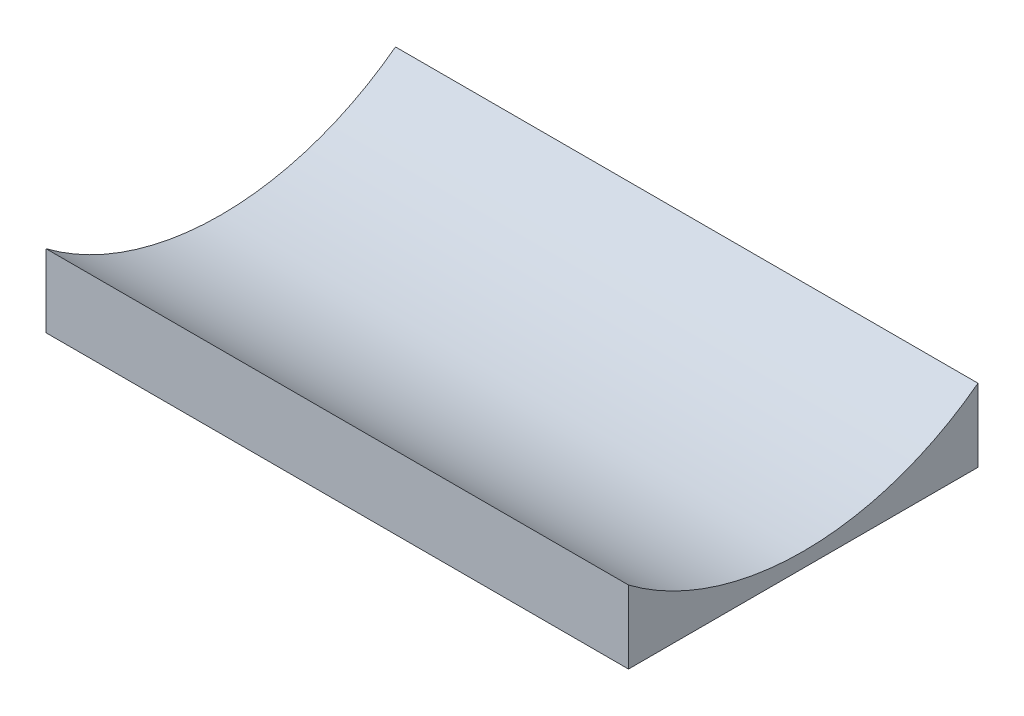
from build123d import *

# Parameters (mm, degrees)
SKETCH1_W               = 100
SKETCH1_H               = 60
BOSS_EXTRUDE4_DEPTH     = 10
CUT_EXTRUDE1_DEPTH      = 105.880884817
CUT_EXTRUDE1_DEPTH_BACK = 100
SKETCH3_W               = 59.99788365
SKETCH3_H               = 10
BOSS_EXTRUDE5_DEPTH     = 100
SKETCH4_W               = 100
SKETCH4_H               = 5
CUT_EXTRUDE2_DEPTH      = 60
SKETCH5_W               = 100
SKETCH5_H               = 2.5
CUT_EXTRUDE3_DEPTH      = 60


with BuildPart() as part:
    # Sketch1 → Boss-Extrude4 (new body)
    with BuildSketch(Plane(origin=(0, 0, 0), x_dir=(1, 0, 0), z_dir=(0, 1, 0))):
        Rectangle(SKETCH1_W, SKETCH1_H)
    extrude(amount=BOSS_EXTRUDE4_DEPTH)

    # Sketch2 → Cut-Extrude1 (cut, two sides: drawn at the far end of the back side and taken through both)
    with BuildSketch(Plane(origin=(50, 0, 0), x_dir=(0, 0, -1), z_dir=(1, 0, 0)).offset(-CUT_EXTRUDE1_DEPTH_BACK)):
        with BuildLine():
            Line((-135.324200485, 88.993150364), (-30, 10))
            ThreePointArc((-30, 10), (0, 0), (30, 10))
            Line((30, 10), (135.324200485, 88.993150364))
            Line((135.324200485, 88.993150364), (135.324200485, 352.303651576))
            Line((135.324200485, 352.303651576), (-135.324200485, 352.303651576))
            Line((-135.324200485, 352.303651576), (-135.324200485, 88.993150364))
        make_face()
    extrude(amount=CUT_EXTRUDE1_DEPTH + CUT_EXTRUDE1_DEPTH_BACK, mode=Mode.SUBTRACT)


with BuildPart() as cut_extrude1_piece_1:
    # of the separate pieces the step leaves, piece 1, a body of its own (cut_extrude1_pieces)
    add(part.part.solids().sort_by_distance((50, 0, 30))[0])



with BuildPart() as cut_extrude1_piece_2:
    # of the separate pieces the step leaves, piece 2, a body of its own (cut_extrude1_pieces)
    add(part.part.solids().sort_by_distance((50, 0, -30))[0])


with BuildPart() as cut_extrude1_piece_1_1:
    add(cut_extrude1_piece_1.part)

    add(cut_extrude1_piece_2.part)  # Boss-Extrude5 merges Cut-Extrude1 piece 2
    # Sketch3 → Boss-Extrude5 (add)
    with BuildSketch(Plane(origin=(50, 0, 0), x_dir=(0, 0, -1), z_dir=(1, 0, 0))):
        with Locations((-0.001058175, -5)):
            Rectangle(SKETCH3_W, SKETCH3_H)
    extrude(amount=-BOSS_EXTRUDE5_DEPTH)

    # Sketch4 → Cut-Extrude2 (cut)
    with BuildSketch(Plane(origin=(0, 0, -29.99788365), x_dir=(-1, 0, 0), z_dir=(0, 0, -1))):
        with Locations((0, -7.5)):
            Rectangle(SKETCH4_W, SKETCH4_H)
    extrude(amount=-CUT_EXTRUDE2_DEPTH, mode=Mode.SUBTRACT)

    # Sketch5 → Cut-Extrude3 (cut)
    with BuildSketch(Plane(origin=(0, 0, -29.99788365), x_dir=(-1, 0, 0), z_dir=(0, 0, -1))):
        with Locations((0, -3.75)):
            Rectangle(SKETCH5_W, SKETCH5_H)
    extrude(amount=-CUT_EXTRUDE3_DEPTH, mode=Mode.SUBTRACT)


solid = cut_extrude1_piece_1_1.part
